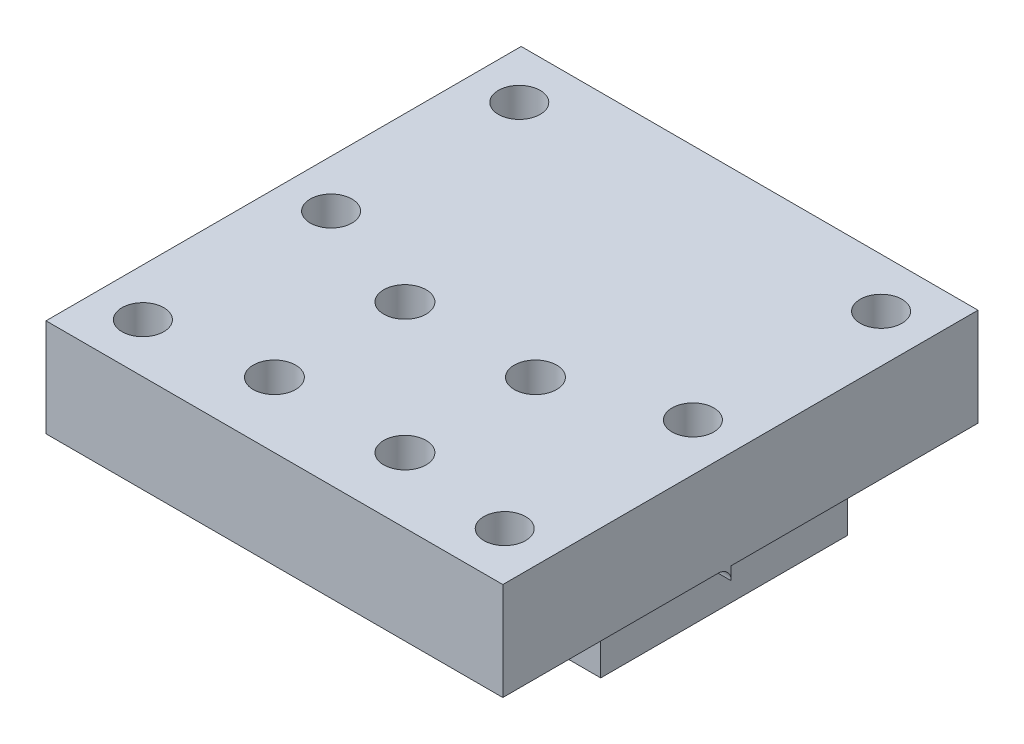
from build123d import *

# Parameters (mm, degrees)
SKETCH1_W           = 70
SKETCH1_H           = 40
SKETCH1_R           = 1.6
BOSS_EXTRUDE1_DEPTH = 15
SKETCH2_R           = 3.25
CUT_EXTRUDE1_DEPTH  = 5
SKETCH3_W           = 70
SKETCH3_H           = 37.813008
BOSS_EXTRUDE2_DEPTH = 39.896897
FILLET1_R           = 2
SKETCH4_R           = 3.2
CUT_EXTRUDE2_DEPTH  = 8
SKETCH5_R           = 3.2
CUT_EXTRUDE3_DEPTH  = 10
CUT_EXTRUDE4_REACH  = 76.873
SKETCH7_W           = 20
SKETCH7_H           = 37.813008
FILLET2_R           = 2


with BuildPart() as part:
    # Sketch1 → Boss-Extrude1 (new body)
    with BuildSketch(Plane(origin=(0, 0, 0), x_dir=(1, 0, 0), z_dir=(0, 1, 0))):
        Rectangle(SKETCH1_W, SKETCH1_H)
        with Locations(Location((10, 10, 0), (0, 0, 270))):
            Circle(SKETCH1_R, mode=Mode.SUBTRACT)
        with Locations(Location((10, -10, 0), (0, 0, 270))):
            Circle(SKETCH1_R, mode=Mode.SUBTRACT)
        with Locations(Location((-10, -10, 0), (0, 0, 270))):
            Circle(SKETCH1_R, mode=Mode.SUBTRACT)
        with Locations(Location((-10, 10, 0), (0, 0, 270))):
            Circle(SKETCH1_R, mode=Mode.SUBTRACT)
    extrude(amount=BOSS_EXTRUDE1_DEPTH)

    # Sketch2 → Cut-Extrude1 (cut)
    with BuildSketch(Plane(origin=(0, 15, 0), x_dir=(1, 0, 0), z_dir=(0, 1, 0))):
        with Locations(Location((10, 10, 0), (0, 0, 270))):
            Circle(SKETCH2_R)
        with Locations(Location((10, -10, 0), (0, 0, 270))):
            Circle(SKETCH2_R)
        with Locations(Location((-10, -10, 0), (0, 0, 270))):
            Circle(SKETCH2_R)
        with Locations(Location((-10, 10, 0), (0, 0, 270))):
            Circle(SKETCH2_R)
    extrude(amount=-CUT_EXTRUDE1_DEPTH, mode=Mode.SUBTRACT)

    # Sketch3 → Boss-Extrude2 (add)
    with BuildSketch(Plane(origin=(0, 15, 0), x_dir=(1, 0, 0), z_dir=(0, 1, 0))):
        with Locations((0, 33.906504)):
            Rectangle(SKETCH3_W, SKETCH3_H)
    extrude(amount=-BOSS_EXTRUDE2_DEPTH)

    # Fillet1
    fillet1_edges = [part.edges().sort_by_distance(p)[0] for p in [
        (0, 0, -15),
    ]]
    fillet(fillet1_edges, radius=FILLET1_R)

    # Sketch4 → Cut-Extrude2 (cut)
    with BuildSketch(Plane(origin=(0, 15, 0), x_dir=(1, 0, 0), z_dir=(0, 1, 0))):
        with Locations(Location((27.721774771, 45.242301259, 0), (0, 0, 270))):
            Circle(SKETCH4_R)
        with Locations(Location((-27.721774771, 45.242301259, 0), (0, 0, 90))):
            Circle(SKETCH4_R)
        with Locations(Location((-27.721774771, -12.429293259, 0), (0, 0, 270))):
            Circle(SKETCH4_R)
        with Locations(Location((27.721774771, -12.429293259, 0), (0, 0, 90))):
            Circle(SKETCH4_R)
        with Locations(Location((27.721774771, 16.406504, 0), (0, 0, 270))):
            Circle(SKETCH4_R)
        with Locations(Location((-27.721774771, 16.406504, 0), (0, 0, 90))):
            Circle(SKETCH4_R)
    extrude(amount=-CUT_EXTRUDE2_DEPTH, mode=Mode.SUBTRACT)

    # Sketch5 → Cut-Extrude3 (cut)
    with BuildSketch(Plane.XZ.offset(24.896897)):
        with Locations(Location((0, -22.906504, 0), (0, 0, 270))):
            Circle(SKETCH5_R)
        with Locations(Location((0, -44.906504, 0), (0, 0, 90))):
            Circle(SKETCH5_R)
        with Locations(Location((-22, -22.906504, 0), (0, 0, 270))):
            Circle(SKETCH5_R)
        with Locations(Location((-22, -44.906504, 0), (0, 0, 90))):
            Circle(SKETCH5_R)
    extrude(amount=-CUT_EXTRUDE3_DEPTH, mode=Mode.SUBTRACT)

    # Cut-Extrude4: up to this face of the body (flat: up to its plane)
    cut_extrude4_end = Plane(part.part.faces().sort_by_distance((0, 0, 3.549430676))[0])
    # Sketch7 → Cut-Extrude4 (cut, up to the picked face)
    with BuildSketch(Plane.XZ.offset(24.896897), mode=Mode.PRIVATE) as cut_extrude4_sk1:
        with Locations((25, -33.906504)):
            Rectangle(SKETCH7_W, SKETCH7_H)
    cut_extrude4_tool1 = split(extrude(cut_extrude4_sk1.sketch, amount=-CUT_EXTRUDE4_REACH, mode=Mode.PRIVATE), bisect_by=cut_extrude4_end, keep=Keep.BOTH, mode=Mode.PRIVATE)
    add(cut_extrude4_tool1.solids().sort_by(Axis((25, -24.896897, -33.906504), (0, 1, 0)))[0], mode=Mode.SUBTRACT)

    # Fillet2
    fillet2_edges = [part.edges().sort_by_distance(p)[0] for p in [
        (15, 0, -33.906504),
    ]]
    fillet(fillet2_edges, radius=FILLET2_R)


solid = part.part
